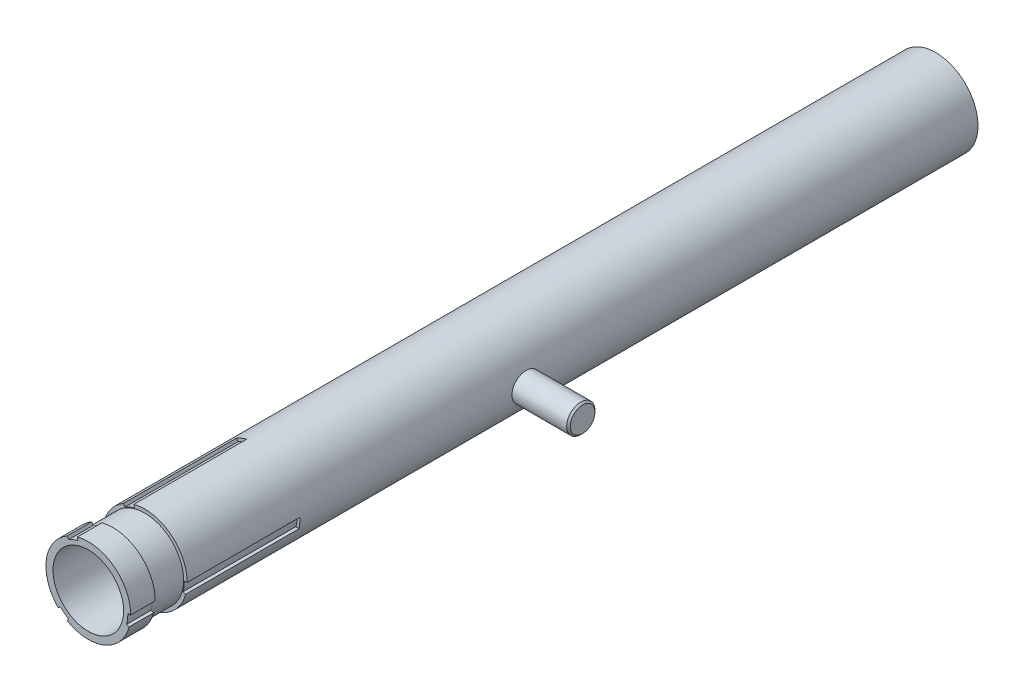
from build123d import *

# Parameters (mm, degrees)
SKETCH1_R             = 19.05
SKETCH1_R_2           = 15.875
EXTRUDE_1968T51_DEPTH = 914.4
SKETCH2_R             = 19.05
CUT_EXTRUDE1_DEPTH    = 76.2
SKETCH3_R             = 6.35
EXTRUDE_9061K36_DEPTH = 304.8
SKETCH5_R             = 6.35
CUT_EXTRUDE3_DEPTH    = 279.4
CHAMFER1_SIZE         = 0.79375
CUT_EXTRUDE4_START    = -457.2
SKETCH6_R             = 19.05
CUT_EXTRUDE4_DEPTH    = 457.2
CUT_EXTRUDE5_START    = -76.2
CUT_EXTRUDE5_DEPTH    = 76.2
CUT_EXTRUDE6_START    = -25.4
SKETCH8_R             = 19.05
SKETCH8_R_2           = 17.4625
CUT_EXTRUDE6_DEPTH    = 14.351


with BuildPart() as part:
    # Sketch1 → Extrude 1968T51 (new body)
    with BuildSketch(Plane.XY):
        Circle(SKETCH1_R)
        Circle(SKETCH1_R_2, mode=Mode.SUBTRACT)
    extrude(amount=EXTRUDE_1968T51_DEPTH)

    # Sketch2 → Cut-Extrude1 (cut)
    with BuildSketch(Plane.XY):
        Circle(SKETCH2_R)
    extrude(amount=CUT_EXTRUDE1_DEPTH, mode=Mode.SUBTRACT)

    # Sketch6 → Cut-Extrude4 (cut)
    with BuildSketch(Plane.XY.offset(914.4).offset(CUT_EXTRUDE4_START)):
        Circle(SKETCH6_R)
    extrude(amount=CUT_EXTRUDE4_DEPTH, mode=Mode.SUBTRACT)

    # Sketch7 → Cut-Extrude5 (cut)
    with BuildSketch(Plane.XY.offset(457.2).offset(CUT_EXTRUDE5_START)):
        with BuildLine():
            Line((19.05, 0), (17.78, 0))
            ThreePointArc((17.78, 0), (17.627889635, -2.320755698), (17.174161191, -4.601802622))
            Line((17.174161191, -4.601802622), (18.400886991, -4.930502809))
            ThreePointArc((18.400886991, -4.930502809), (18.887024609, -2.486523962), (19.05, 0))
        make_face()
        with BuildLine():
            Line((-9.525, -16.497783942), (-8.89, -15.397931679))
            ThreePointArc((-8.89, -15.397931679), (-10.823778208, -14.10582239), (-12.572358569, -12.572358569))
            Line((-12.572358569, -12.572358569), (-13.470384182, -13.470384182))
            ThreePointArc((-13.470384182, -13.470384182), (-11.596905223, -15.113381133), (-9.525, -16.497783942))
        make_face()
        with BuildLine():
            Line((-9.525, 16.497783942), (-8.89, 15.397931679))
            ThreePointArc((-8.89, 15.397931679), (-6.804111427, 16.426578088), (-4.601802622, 17.174161191))
            Line((-4.601802622, 17.174161191), (-4.930502809, 18.400886991))
            ThreePointArc((-4.930502809, 18.400886991), (-7.290119387, 17.599905094), (-9.525, 16.497783942))
        make_face()
    extrude(amount=CUT_EXTRUDE5_DEPTH, mode=Mode.SUBTRACT)

    # Sketch8 → Cut-Extrude6 (cut)
    with BuildSketch(Plane.XY.offset(457.2).offset(CUT_EXTRUDE6_START)):
        Circle(SKETCH8_R)
        with Locations(Location((0, 0, 0), (0, 0, 180))):
            Circle(SKETCH8_R_2, mode=Mode.SUBTRACT)
    extrude(amount=CUT_EXTRUDE6_DEPTH, mode=Mode.SUBTRACT)


with BuildPart() as body_2:
    # Sketch3 → Extrude 9061K36 (new body)
    with BuildSketch(Plane(origin=(19.05, 0, 0), x_dir=(0, 0, -1), z_dir=(1, 0, 0))):
        with Locations(Location((-279.4, 0, 0), (0, 0, 180))):
            Circle(SKETCH3_R)
    extrude(amount=EXTRUDE_9061K36_DEPTH)

    # Sketch5 → Cut-Extrude3 (cut)
    with BuildSketch(Plane(origin=(323.85, 0, 0), x_dir=(0, 0, -1), z_dir=(1, 0, 0))):
        with Locations(Location((-279.4, 0, 0), (0, 0, 180))):
            Circle(SKETCH5_R)
    extrude(amount=-CUT_EXTRUDE3_DEPTH, mode=Mode.SUBTRACT)

    # Chamfer1
    chamfer1_edges = [body_2.edges().sort_by_distance(p)[0] for p in [
        (44.45, 0, 273.05),
    ]]
    chamfer(chamfer1_edges, length=CHAMFER1_SIZE)


solid = Compound([part.part, body_2.part])
